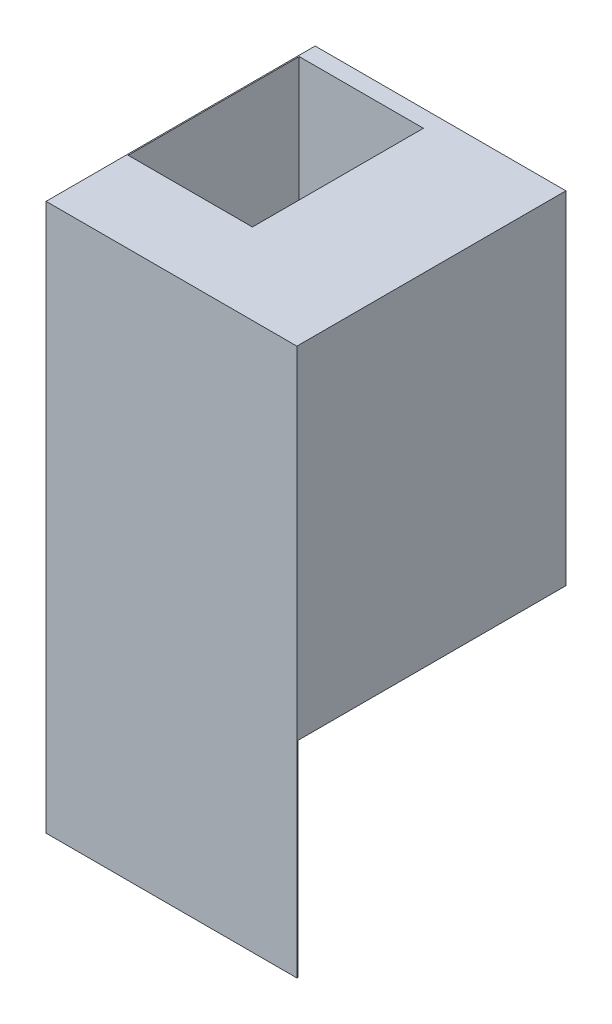
from build123d import *

# Parameters (mm, degrees)
ESQUISSE1_W             = 2200
ESQUISSE1_H             = 4800
BOSS_EXTRU_1_DEPTH      = 10
BOSS_EXTRU_3_DEPTH      = 1100
ESQUISSE11_W            = 1100
ESQUISSE11_H            = 3000
BOSS_EXTRU_5_DEPTH      = 2200
ESQUISSE12_W            = 1080
ESQUISSE12_H            = 2980
ENL_V_MAT_EXTRU_1_DEPTH = 2200
ENL_V_MAT_EXTRU_2_REACH = 5276.207
ESQUISSE14_W            = 2200
ESQUISSE14_H            = 150
BOSS_EXTRU_12_DEPTH     = 3000
BOSS_EXTRU_13_DEPTH     = 10


with BuildPart() as part:
    # Esquisse1 → Boss.-Extru.1 (new body)
    with BuildSketch(Plane.XY):
        with Locations((1080.243264597, 2265.539904099)):
            Rectangle(ESQUISSE1_W, ESQUISSE1_H)
    extrude(amount=BOSS_EXTRU_1_DEPTH)

    # Esquisse3 → Boss.-Extru.3 (add)
    with BuildSketch(Plane.ZY.offset(19.756735403)):
        Polygon((0, 4665.539904099), (-700, 4665.539904099), (0, 3665.539904099), align=None)
    extrude(amount=-BOSS_EXTRU_3_DEPTH)

    # Esquisse11 → Boss.-Extru.5 (add)
    with BuildSketch(Plane(origin=(0, 0, 0), x_dir=(-1, 0, 0), z_dir=(0, 0, -1))):
        with Locations((-1630.243264597, 3165.539904099)):
            Rectangle(ESQUISSE11_W, ESQUISSE11_H)
    extrude(amount=BOSS_EXTRU_5_DEPTH)

    # Esquisse12 → Enlèv. mat.-Extru.1 (cut)
    with BuildSketch(Plane(origin=(0, 0, -2200), x_dir=(-1, 0, 0), z_dir=(0, 0, -1))):
        with Locations((-1630.243264597, 3165.539904099)):
            Rectangle(ESQUISSE12_W, ESQUISSE12_H)
    extrude(amount=-ENL_V_MAT_EXTRU_1_DEPTH, mode=Mode.SUBTRACT)

    # Esquisse13 → Enlèv. mat.-Extru.2 (cut, up to next)
    with BuildSketch(Plane.ZY.offset(-1080.243264597), mode=Mode.PRIVATE) as enl_v_mat_extru_2_sk1:
        with BuildLine():
            Line((0, 2215.539904099), (-1450, 2215.539904099))
            ThreePointArc((-1450, 2215.539904099), (-1697.487373415, 2318.052530684), (-1800, 2565.539904099))
            Line((-1800, 2565.539904099), (-1800, 2765.539904099))
            ThreePointArc((-1800, 2765.539904099), (-1697.487373415, 3013.027277514), (-1450, 3115.539904099))
            Line((-1450, 3115.539904099), (0, 3115.539904099))
            Line((0, 3115.539904099), (0, 2215.539904099))
        make_face()
    enl_v_mat_extru_2_tool1 = extrude(enl_v_mat_extru_2_sk1.sketch, amount=-ENL_V_MAT_EXTRU_2_REACH, mode=Mode.PRIVATE) & part.part
    add(enl_v_mat_extru_2_tool1.solids().sort_by_distance((1080.243265, 2665.539904, -872.432919))[0], mode=Mode.SUBTRACT)

    # Esquisse14 → Boss.-Extru.12 (add)
    with BuildSketch(Plane.XZ.offset(-1665.539904099)):
        with Locations((1080.243264597, -2275)):
            Rectangle(ESQUISSE14_W, ESQUISSE14_H)
    extrude(amount=-BOSS_EXTRU_12_DEPTH)

    # Esquisse16 → Boss.-Extru.13 (add)
    with BuildSketch(Plane.ZY.offset(19.756735403)):
        Polygon((0, -134.460095901), (-1538.867991766, -134.460095901), (-2350, -134.460095901), (-2350, 4665.539904099), (-700, 4665.539904099), (0, 3665.539904099), align=None)
    extrude(amount=-BOSS_EXTRU_13_DEPTH)


solid = part.part
